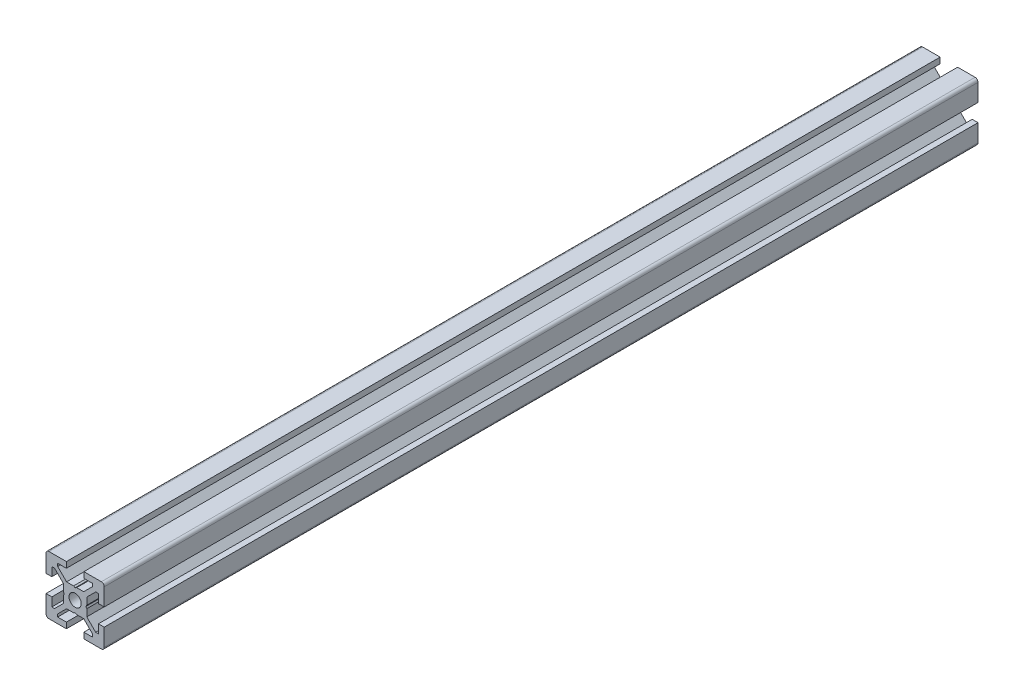
from build123d import *

# Parameters (mm, degrees)
MODEL_R         = 2.1
EXTRUDE_1_DEPTH = 300


with BuildPart() as part:
    # Model → 보스-돌출1 (new body)
    with BuildSketch(Plane.XY):
        with BuildLine():
            Line((-10, 3), (-8, 3))
            Line((-8, 3), (-8, 6))
            Line((-8, 6), (-7.060660172, 6))
            Line((-7.060660172, 6), (-4, 2.939339828))
            Line((-4, 2.939339828), (-4, 0.519615242))
            Line((-4, 0.519615242), (-3.7, 0))
            Line((-3.7, 0), (-4, -0.519615242))
            Line((-4, -0.519615242), (-4, -2.939339828))
            Line((-4, -2.939339828), (-7.060660172, -6))
            Line((-7.060660172, -6), (-8, -6))
            Line((-8, -6), (-8, -3))
            Line((-8, -3), (-10, -3))
            Line((-10, -3), (-10, -9))
            ThreePointArc((-10, -9), (-9.707106781, -9.707106781), (-9, -10))
            Line((-9, -10), (-3, -10))
            Line((-3, -10), (-3, -8))
            Line((-3, -8), (-6, -8))
            Line((-6, -8), (-6, -7.060660172))
            Line((-6, -7.060660172), (-2.939339828, -4))
            Line((-2.939339828, -4), (-0.519615242, -4))
            Line((-0.519615242, -4), (0, -3.7))
            Line((0, -3.7), (0.519615242, -4))
            Line((0.519615242, -4), (2.939339828, -4))
            Line((2.939339828, -4), (6, -7.060660172))
            Line((6, -7.060660172), (6, -8))
            Line((6, -8), (3, -8))
            Line((3, -8), (3, -10))
            Line((3, -10), (9, -10))
            ThreePointArc((9, -10), (9.707106781, -9.707106781), (10, -9))
            Line((10, -9), (10, -3))
            Line((10, -3), (8, -3))
            Line((8, -3), (8, -6))
            Line((8, -6), (7.060660172, -6))
            Line((7.060660172, -6), (4, -2.939339828))
            Line((4, -2.939339828), (4, -0.519615242))
            Line((4, -0.519615242), (3.7, 0))
            Line((3.7, 0), (4, 0.519615242))
            Line((4, 0.519615242), (4, 2.939339828))
            Line((4, 2.939339828), (7.060660172, 6))
            Line((7.060660172, 6), (8, 6))
            Line((8, 6), (8, 3))
            Line((8, 3), (10, 3))
            Line((10, 3), (10, 9))
            ThreePointArc((10, 9), (9.707106781, 9.707106781), (9, 10))
            Line((9, 10), (3, 10))
            Line((3, 10), (3, 8))
            Line((3, 8), (6, 8))
            Line((6, 8), (6, 7.060660172))
            Line((6, 7.060660172), (2.939339828, 4))
            Line((2.939339828, 4), (0.519615242, 4))
            Line((0.519615242, 4), (0, 3.7))
            Line((0, 3.7), (-0.519615242, 4))
            Line((-0.519615242, 4), (-2.939339828, 4))
            Line((-2.939339828, 4), (-6, 7.060660172))
            Line((-6, 7.060660172), (-6, 8))
            Line((-6, 8), (-3, 8))
            Line((-3, 8), (-3, 10))
            Line((-3, 10), (-9, 10))
            ThreePointArc((-9, 10), (-9.707106781, 9.707106781), (-10, 9))
            Line((-10, 9), (-10, 3))
        make_face()
        Circle(MODEL_R, mode=Mode.SUBTRACT)
    extrude(amount=EXTRUDE_1_DEPTH)


solid = part.part
